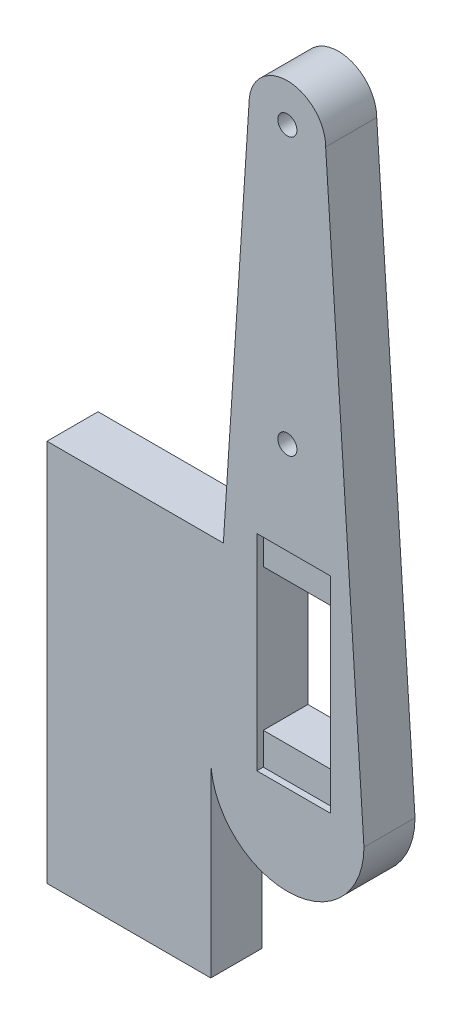
from build123d import *

# Parameters (mm, degrees)
SKETCH1_R               = 1.5
BOSS_EXTRUDE1_DEPTH     = 8
CUT_EXTRUDE1_DEPTH      = 69.992355237
CUT_EXTRUDE1_DEPTH_BACK = 20
SKETCH2_W               = 11.5
SKETCH2_H               = 22.2
SKETCH2_3_W             = 11.5
SKETCH2_3_H             = 5
CUT_EXTRUDE2_DEPTH      = 1


with BuildPart() as part:
    # Sketch1 → Boss-Extrude1 (new body)
    with BuildSketch(Plane.XY):
        with BuildLine():
            Line((18.829016979, 57.870689655), (24.829016979, -34.129310345))
            ThreePointArc((24.829016979, -34.129310345), (12.829016979, -46.129310345), (0.829016979, -34.129310345))
            Line((0.829016979, -34.129310345), (0.829016979, -63.870689655))
            Line((0.829016979, -63.870689655), (-24.829016979, -63.870689655))
            Line((-24.829016979, -63.870689655), (-24.829016979, -3.870689655))
            Line((-24.829016979, -3.870689655), (2.802405285, -3.870689655))
            Line((2.802405285, -3.870689655), (6.829016979, 57.870689655))
            ThreePointArc((6.829016979, 57.870689655), (12.829016979, 63.870689655), (18.829016979, 57.870689655))
        make_face()
        with Locations((12.829016979, 57.870689655)):
            Circle(SKETCH1_R, mode=Mode.SUBTRACT)
        with Locations((12.829016979, 14.570689655)):
            Circle(SKETCH1_R, mode=Mode.SUBTRACT)
    extrude(amount=BOSS_EXTRUDE1_DEPTH)

    # Sketch2 → Cut-Extrude1 (cut, two sides: drawn at the far end of the back side and taken through both)
    with BuildSketch(Plane.XY.offset(8).offset(-CUT_EXTRUDE1_DEPTH_BACK)):
        with Locations((13.802405285, -16.049310345)):
            Rectangle(SKETCH2_W, SKETCH2_H)
    extrude(amount=CUT_EXTRUDE1_DEPTH + CUT_EXTRUDE1_DEPTH_BACK, mode=Mode.SUBTRACT)

    # Sketch2<3> → Cut-Extrude2 (cut)
    with BuildSketch(Plane.XY.offset(8)):
        with Locations((13.802405285, -2.449310345)):
            Rectangle(SKETCH2_3_W, SKETCH2_3_H)
        with Locations((13.802405285, -29.649310345)):
            Rectangle(SKETCH2_3_W, SKETCH2_3_H)
    extrude(amount=-CUT_EXTRUDE2_DEPTH, mode=Mode.SUBTRACT)


solid = part.part
